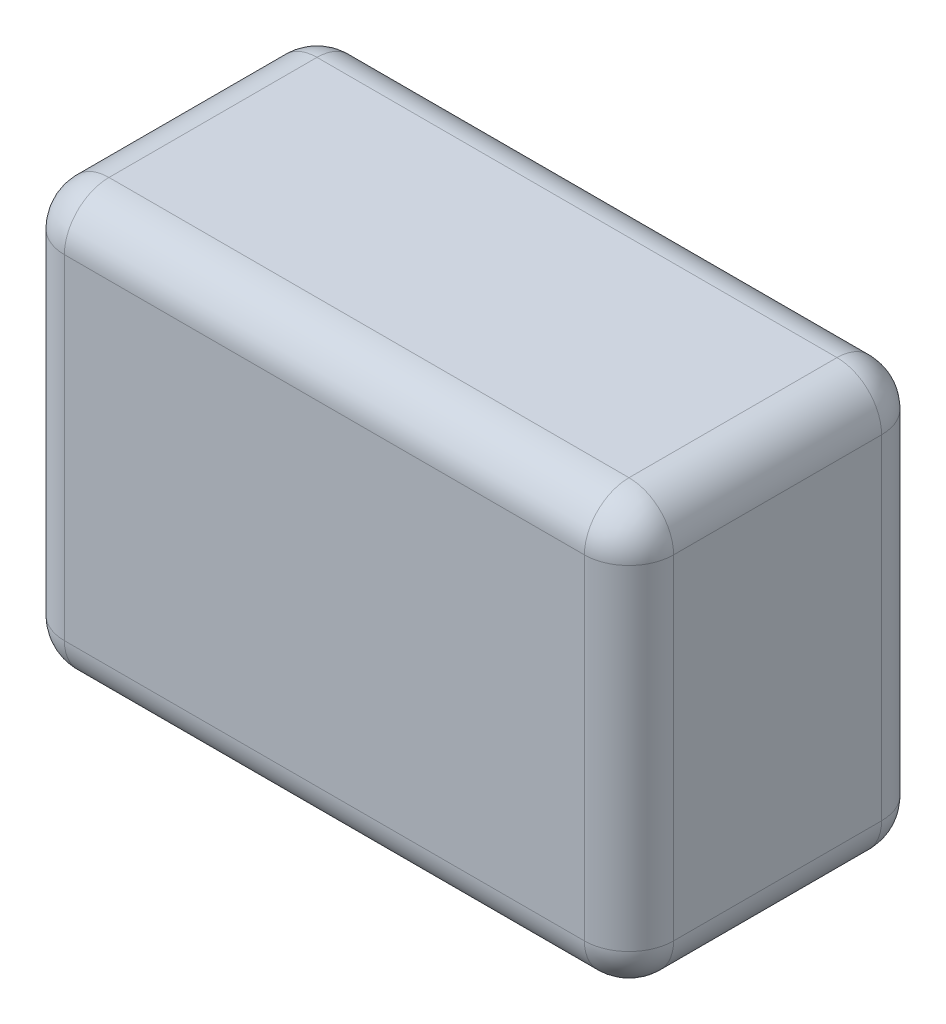
from build123d import *

# Parameters (mm, degrees)
SKETCH1_W           = 82
SKETCH1_H           = 40
BOSS_EXTRUDE1_DEPTH = 28.5
FILLET1_R           = 6


with BuildPart() as part:
    # Sketch1 → Boss-Extrude1 (new, symmetric)
    with BuildSketch(Plane(origin=(0, 0, 0), x_dir=(1, 0, 0), z_dir=(0, 1, 0))):
        Rectangle(SKETCH1_W, SKETCH1_H)
    extrude(amount=BOSS_EXTRUDE1_DEPTH, both=True)

    # Fillet1
    fillet1_edges = [part.edges().sort_by_distance(p)[0] for p in [
        (41, 28.5, 0),
        (0, 28.5, -20),
        (-41, 28.5, 0),
        (0, -28.5, -20),
        (41, -28.5, 0),
        (0, -28.5, 20),
        (-41, -28.5, 0),
        (-41, 0, -20),
        (41, 0, -20),
        (41, 0, 20),
        (-41, 0, 20),
        (0, 28.5, 20),
    ]]
    fillet(fillet1_edges, radius=FILLET1_R)


solid = part.part
